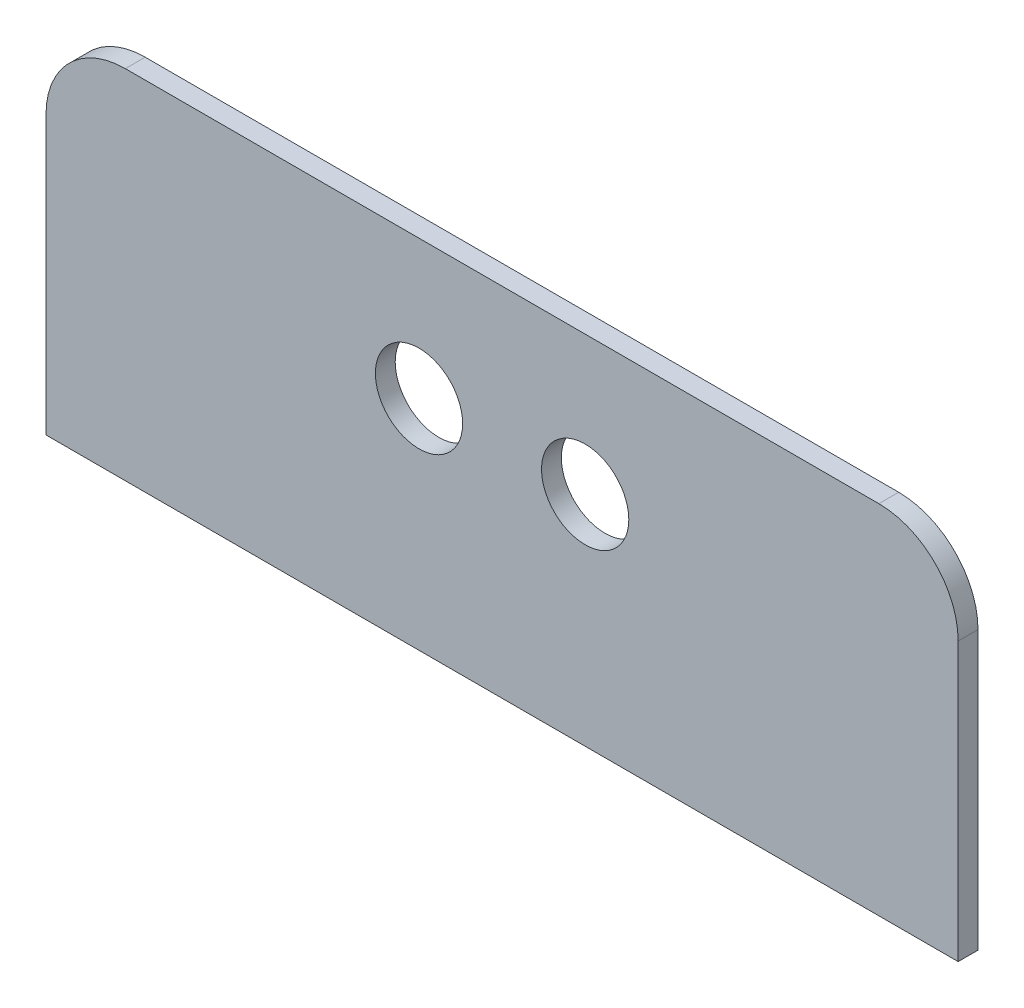
from build123d import *

# Parameters (mm, degrees)
SKETCH1_W           = 230
SKETCH1_H           = 90
BOSS_EXTRUDE1_DEPTH = 5
FILLET1_R           = 20
CUT_EXTRUDE1_REACH  = 125.592
SKETCH2_R           = 11


with BuildPart() as part:
    # Sketch1 → Boss-Extrude1 (new body)
    with BuildSketch(Plane.XY):
        Rectangle(SKETCH1_W, SKETCH1_H)
    extrude(amount=BOSS_EXTRUDE1_DEPTH)

    # Fillet1
    fillet1_edges = [part.edges().sort_by_distance(p)[0] for p in [
        (-115, 45, 2.5),
        (115, 45, 2.5),
    ]]
    fillet(fillet1_edges, radius=FILLET1_R)

    # Sketch2 → Cut-Extrude1 (cut, up to next)
    with BuildSketch(Plane.XY.offset(5), mode=Mode.PRIVATE) as cut_extrude1_sk1:
        with Locations((-20.95, 10)):
            Circle(SKETCH2_R)
    cut_extrude1_tool1 = extrude(cut_extrude1_sk1.sketch, amount=-CUT_EXTRUDE1_REACH, mode=Mode.PRIVATE) & part.part
    # Sketch2 → Cut-Extrude1 (cut, up to next)
    with BuildSketch(Plane.XY.offset(5), mode=Mode.PRIVATE) as cut_extrude1_sk2:
        with Locations((20.95, 10)):
            Circle(SKETCH2_R)
    cut_extrude1_tool2 = extrude(cut_extrude1_sk2.sketch, amount=-CUT_EXTRUDE1_REACH, mode=Mode.PRIVATE) & part.part
    add(cut_extrude1_tool1.solids().sort_by_distance((-20.95, 10, 5))[0], mode=Mode.SUBTRACT)
    add(cut_extrude1_tool2.solids().sort_by_distance((20.95, 10, 5))[0], mode=Mode.SUBTRACT)


solid = part.part
